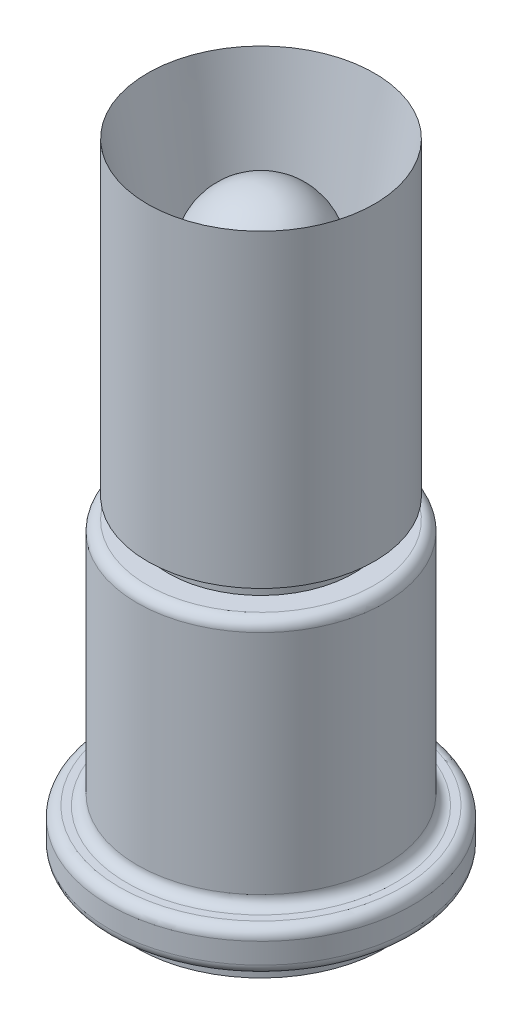
from build123d import *

# Parameters (mm, degrees)
SKETCH2_W = 3
SKETCH2_H = 0.5
FILLET1_R = 0.25


with BuildPart() as part:
    # Sketch1 → Revolve1 (revolve)
    with BuildSketch(Plane(origin=(0, 0, 0), x_dir=(0, 0, -1), z_dir=(1, 0, 0)), mode=Mode.PRIVATE) as revolve1_sk:
        Polygon((0, 0), (3.68, 0), (3.68, 1), (3, 1), (3, 7), (2.25, 7), (2.25, 7.5), (2.75, 7.5), (2.75, 15), (0, 15), align=None)
    revolve(revolve1_sk.sketch.rotate(Axis((0, 15, 0), (0, -1, 0)), 180), axis=Axis((0, 15, 0), (0, -1, 0)))

    # Sketch2 → Revolve2 (revolve)
    with BuildSketch(Plane(origin=(0, 0, 0), x_dir=(0, 0, -1), z_dir=(1, 0, 0)), mode=Mode.PRIVATE) as revolve2_sk:
        with Locations((1.5, -0.25)):
            Rectangle(SKETCH2_W, SKETCH2_H)
    revolve(revolve2_sk.sketch.rotate(Axis((0, 0, 0), (0, -1, 0)), 180), axis=Axis((0, 0, 0), (0, -1, 0)))

    # Sketch3 → Revolve3 (revolve)
    with BuildSketch(Plane(origin=(0, 0, 0), x_dir=(0, 0, -1), z_dir=(1, 0, 0))):
        with BuildLine():
            Line((0, -1), (0, 1))
            ThreePointArc((0, 1), (1, 0), (0, -1))
        make_face()
    revolve(axis=Axis((0, -1, 0), (0, 1, 0)))

    # Fillet1
    fillet1_edges = [part.edges().sort_by_distance(p)[0] for p in [
        (0, 1, -3.68),
        (0, 0, -3.68),
        (0, 7, -3),
        (0, 1, -3),
    ]]
    fillet(fillet1_edges, radius=FILLET1_R)

    # Sketch5 → Cut-Revolve1 (revolve, cut)
    with BuildSketch(Plane(origin=(0, 0, 0), x_dir=(0, 0, -1), z_dir=(1, 0, 0))):
        Polygon((0, 15), (0, 8), (1.5, 8), (2.75, 15), align=None)
    revolve(axis=Axis((0, 15, 0), (0, -1, 0)), mode=Mode.SUBTRACT)

    # Sketch6 → Revolve4 (revolve)
    with BuildSketch(Plane(origin=(0, 0, 0), x_dir=(0, 0, -1), z_dir=(1, 0, 0))):
        with BuildLine():
            Line((0, 8), (0, 12.5))
            Line((0, 12.5), (0, 14))
            ThreePointArc((0, 14), (1.060660172, 13.560660172), (1.5, 12.5))
            Line((1.5, 12.5), (1.5, 8))
            Line((1.5, 8), (0, 8))
        make_face()
    revolve(axis=Axis((0, 8, 0), (0, 1, 0)))


solid = part.part
